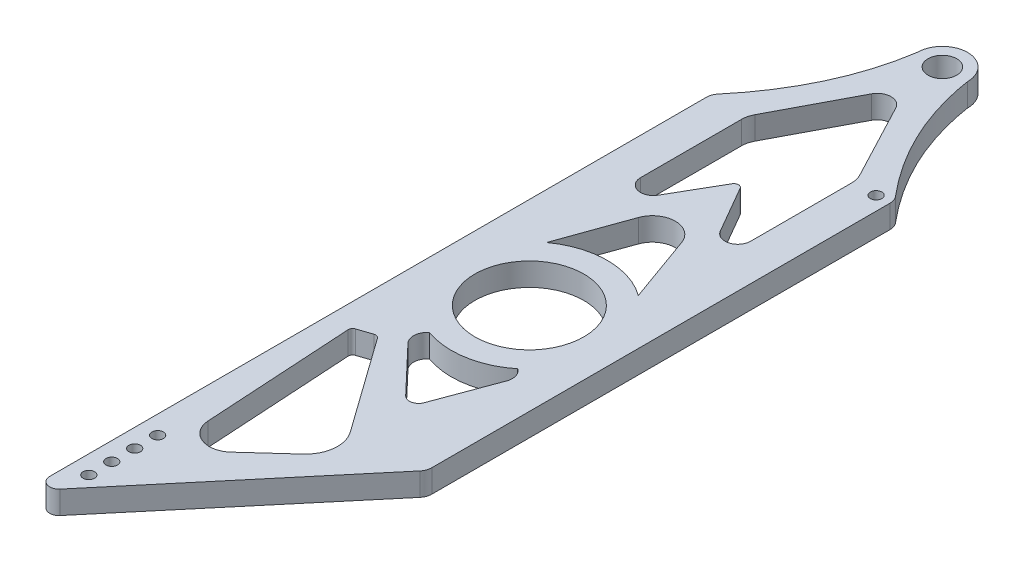
from build123d import *

# Parameters (mm, degrees)
SKETCH1_R           = 3.96875
SKETCH1_R_2         = 15.08125
SKETCH1_R_3         = 1.5875
BOSS_EXTRUDE1_DEPTH = 6.35


with BuildPart() as part:
    # Sketch1 → Boss-Extrude1 (new body)
    with BuildSketch(Plane(origin=(0, 0, 0), x_dir=(1, 0, 0), z_dir=(0, 1, 0))):
        with BuildLine():
            Line((25.4, -39.926769414), (25.4, -166.672190904))
            ThreePointArc((25.4, -166.672190904), (25.170228885, -167.97528765), (24.508629328, -169.121211697))
            Line((24.508629328, -169.121211697), (-20.914247114, -223.254087883))
            ThreePointArc((-20.914247114, -223.254087883), (-23.728731164, -224.008226611), (-25.4, -221.621407355))
            Line((-25.4, -221.621407355), (-25.4, -39.926769414))
            ThreePointArc((-25.4, -39.926769414), (-25.169027772, -38.620377357), (-24.504115377, -37.472379149))
            add(Edge.make_bspline(
                [(-24.504115377, -37.472379149), (-15.341464403, -26.593497135), (-9.143369894, -14.104472305), (-6.985, 0)],
                knots=[0.031078099, 0.031078099, 0.031078099, 0.031078099, 1, 1, 1, 1], degree=3))
            ThreePointArc((-6.985, 0), (0, 6.985), (6.985, 0))
            add(Edge.make_bspline(
                [(24.504115377, -37.472379149), (15.363034866, -26.619107902), (9.178211427, -14.199965817), (6.985, 0)],
                knots=[0.031766068, 0.031766068, 0.031766068, 0.031766068, 1, 1, 1, 1], degree=3))
            ThreePointArc((24.504115377, -37.472379149), (25.169027772, -38.620377357), (25.4, -39.926769414))
        make_face()
        with Locations(Location((0, 0, 0), (0, 0, 270))):
            Circle(SKETCH1_R, mode=Mode.SUBTRACT)
        with Locations(Location((0, -114.3, 0), (0, 0, 270))):
            Circle(SKETCH1_R_2, mode=Mode.SUBTRACT)
        with Locations(Location((-20.32, -215.9, 0), (0, 0, 270))):
            Circle(SKETCH1_R_3, mode=Mode.SUBTRACT)
        with Locations(Location((-20.32, -209.55, 0), (0, 0, 270))):
            Circle(SKETCH1_R_3, mode=Mode.SUBTRACT)
        with Locations(Location((-20.32, -203.2, 0), (0, 0, 270))):
            Circle(SKETCH1_R_3, mode=Mode.SUBTRACT)
        with Locations(Location((-20.32, -196.85, 0), (0, 0, 270))):
            Circle(SKETCH1_R_3, mode=Mode.SUBTRACT)
        with Locations(Location((21.59, -39.926769414, 0), (0, 0, 270))):
            Circle(SKETCH1_R_3, mode=Mode.SUBTRACT)
        with BuildLine():
            Line((5.605496622, -169.473670788), (-13.166879596, -143.176324304))
            ThreePointArc((-13.166879596, -143.176324304), (-13.808086261, -142.706355865), (-14.603073846, -142.709681833))
            Line((-14.603073846, -142.709681833), (-18.395861473, -143.977201329))
            ThreePointArc((-18.395861473, -143.977201329), (-19.045805463, -144.470960171), (-19.26101006, -145.258305054))
            Line((-19.26101006, -145.258305054), (-16.771936742, -186.45833168))
            ThreePointArc((-16.771936742, -186.45833168), (-12.825939472, -191.957464848), (-6.161826947, -190.773841461))
            Line((-6.161826947, -190.773841461), (4.350250475, -181.216613261))
            ThreePointArc((4.350250475, -181.216613261), (7.209558699, -175.583695027), (5.605496622, -169.473670788))
        make_face(mode=Mode.SUBTRACT)
        with BuildLine():
            Line((4.532066161, -153.060524084), (-7.713720706, -140.184809241))
            ThreePointArc((-7.713720706, -140.184809241), (-8.755006703, -137.313107924), (-7.352336236, -134.599538218))
            ThreePointArc((-7.352336236, -134.599538218), (3.568908967, -135.592979801), (13.569379689, -131.092856661))
            ThreePointArc((13.569379689, -131.092856661), (15.024402409, -133.082319121), (14.957124713, -135.546162806))
            Line((14.957124713, -135.546162806), (8.752708503, -152.196945016))
            ThreePointArc((8.752708503, -152.196945016), (6.881732179, -153.798504677), (4.532066161, -153.060524084))
        make_face(mode=Mode.SUBTRACT)
        with BuildLine():
            Line((-12.7, -96.840386602), (-5.976567434, -78.111338504))
            ThreePointArc((-5.976567434, -78.111338504), (0, -73.906831852), (5.976567434, -78.111338504))
            Line((5.976567434, -78.111338504), (12.7, -96.840386602))
            ThreePointArc((12.7, -96.840386602), (0, -92.71), (-12.7, -96.840386602))
        make_face(mode=Mode.SUBTRACT)
        with BuildLine():
            Line((-3.370875395, -16.243299574), (-14.508125658, -37.384911468))
            ThreePointArc((-14.508125658, -37.384911468), (-15.054316585, -38.820130907), (-15.24, -40.344499969))
            Line((-15.24, -40.344499969), (-15.24, -68.284499969))
            ThreePointArc((-15.24, -68.284499969), (-12.604360524, -71.719332208), (-8.604413664, -70.062499969))
            Line((-8.604413664, -70.062499969), (-1.099852263, -57.064218334))
            ThreePointArc((-1.099852263, -57.064218334), (0, -56.429218334), (1.099852263, -57.064218334))
            Line((1.099852263, -57.064218334), (8.604413664, -70.062499969))
            ThreePointArc((8.604413664, -70.062499969), (12.604360524, -71.719332208), (15.24, -68.284499969))
            Line((15.24, -68.284499969), (15.24, -40.344499969))
            ThreePointArc((15.24, -40.344499969), (15.054316585, -38.820130907), (14.508125658, -37.384911468))
            Line((14.508125658, -37.384911468), (3.370875395, -16.243299574))
            ThreePointArc((3.370875395, -16.243299574), (0, -14.209052675), (-3.370875395, -16.243299574))
        make_face(mode=Mode.SUBTRACT)
    extrude(amount=-BOSS_EXTRUDE1_DEPTH)


solid = part.part
